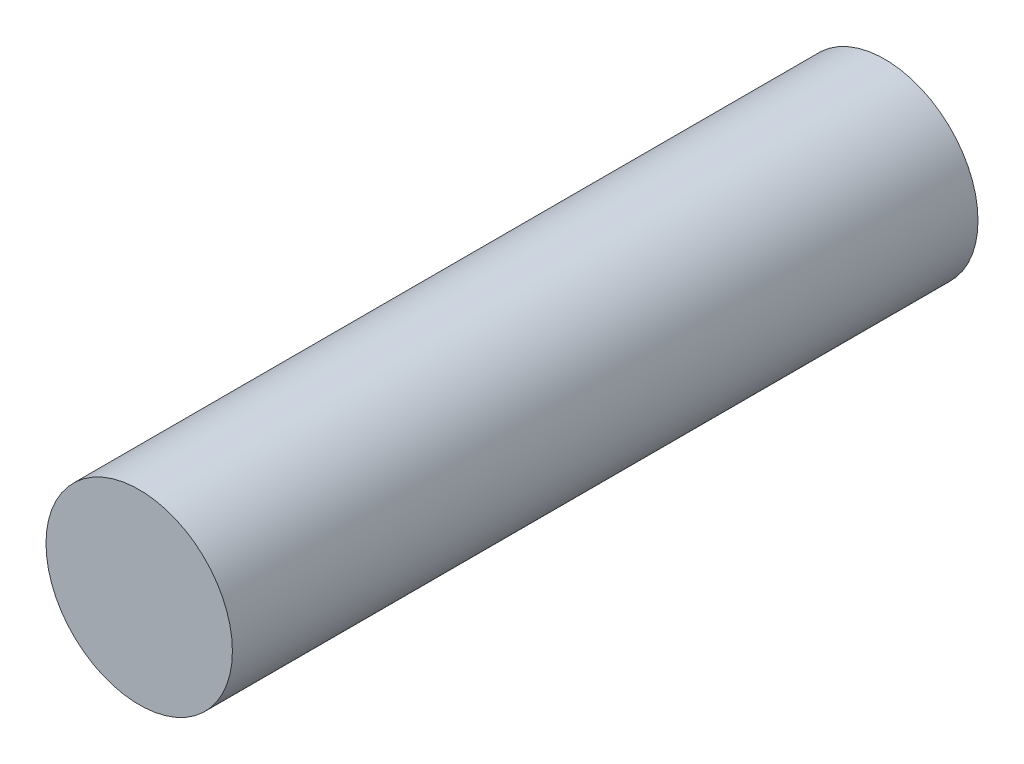
from build123d import *

# Parameters (mm, degrees)
SKETCH1_R           = 38.1
BOSS_EXTRUDE1_DEPTH = 152.4


with BuildPart() as part:
    # Sketch1 → Boss-Extrude1 (new, symmetric)
    with BuildSketch(Plane.XY):
        with Locations(Location((0, 0, 0), (0, 0, 180))):
            Circle(SKETCH1_R)
    extrude(amount=BOSS_EXTRUDE1_DEPTH, both=True)


solid = part.part
